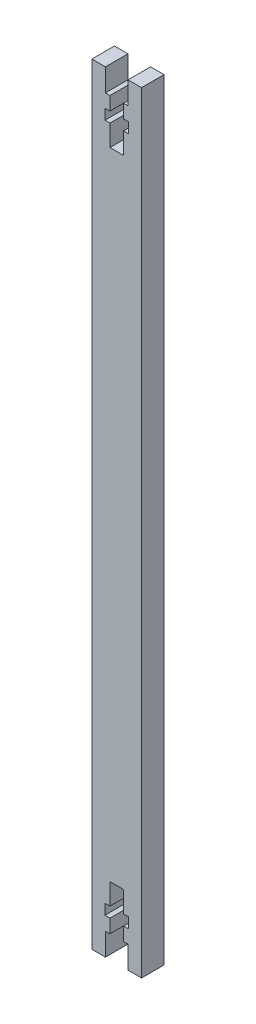
from build123d import *

# Parameters (mm, degrees)
BOSS_EXTRUDE1_DEPTH = 5


with BuildPart() as part:
    # Sketch1 → Boss-Extrude1 (new body)
    with BuildSketch(Plane.XY):
        Polygon((-9, 166), (-9, 5), (-9, 0), (-12, 0), (-12, 5), (-13, 5), (-13, 8), (-11.9, 8), (-11.9, 10.3), (-13, 10.3), (-13, 15), (-16, 15), (-16, 10.3), (-17.1, 10.3), (-17.1, 8), (-16, 8), (-16, 5), (-17, 5), (-17, 0), (-20, 0), (-20, 5), (-20, 166), (-20, 171), (-17, 171), (-17, 166), (-16, 166), (-16, 163), (-17.1, 163), (-17.1, 160.7), (-16, 160.7), (-16, 156), (-13, 156), (-13, 160.7), (-11.9, 160.7), (-11.9, 163), (-13, 163), (-13, 166), (-12, 166), (-12, 171), (-9, 171), align=None)
    extrude(amount=BOSS_EXTRUDE1_DEPTH)


solid = part.part
